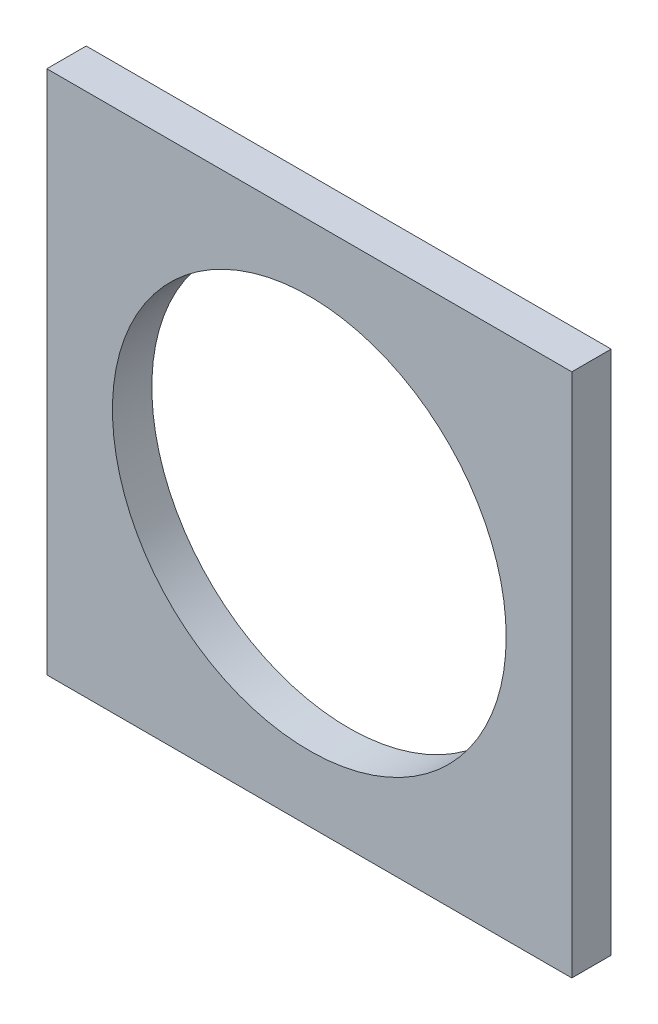
from build123d import *

# Parameters (mm, degrees)
CROQUIS1_W              = 40
CROQUIS1_H              = 40
CROQUIS1_R              = 15
SALIENTE_EXTRUIR1_DEPTH = 3


with BuildPart() as part:
    # Croquis1 → Saliente-Extruir1 (new body)
    with BuildSketch(Plane.XY):
        Rectangle(CROQUIS1_W, CROQUIS1_H)
        Circle(CROQUIS1_R, mode=Mode.SUBTRACT)
    extrude(amount=SALIENTE_EXTRUIR1_DEPTH)


solid = part.part
